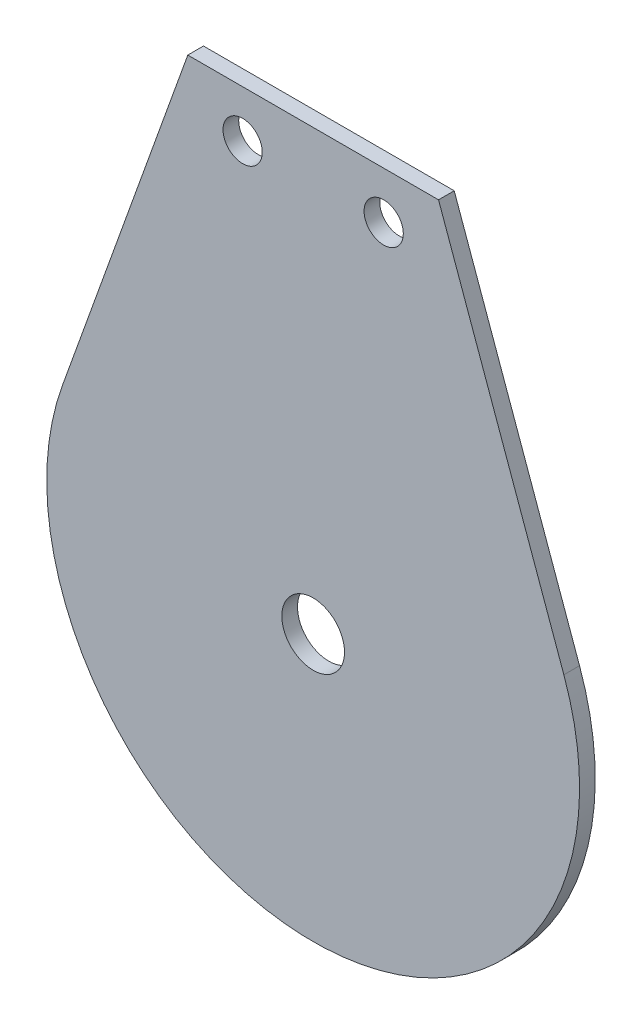
from build123d import *

# Parameters (mm, degrees)
SKETCH1_R           = 3.9751
SKETCH1_R_2         = 6.35
BOSS_EXTRUDE1_DEPTH = 3.175


with BuildPart() as part:
    # Sketch1 → Boss-Extrude1 (new body)
    with BuildSketch(Plane.XY):
        with BuildLine():
            Line((-25.4, 88.9), (25.4, 88.9))
            Line((25.4, 88.9), (50.793088675, 18.258224664))
            ThreePointArc((50.793088675, 18.258224664), (0, -53.975), (-50.793088675, 18.258224664))
            Line((-50.793088675, 18.258224664), (-25.4, 88.9))
        make_face()
        with Locations((14.2875, 79.375)):
            Circle(SKETCH1_R, mode=Mode.SUBTRACT)
        with Locations(Location((-14.2875, 79.375, 0), (0, 0, 180))):
            Circle(SKETCH1_R, mode=Mode.SUBTRACT)
        Circle(SKETCH1_R_2, mode=Mode.SUBTRACT)
    extrude(amount=BOSS_EXTRUDE1_DEPTH)


solid = part.part
